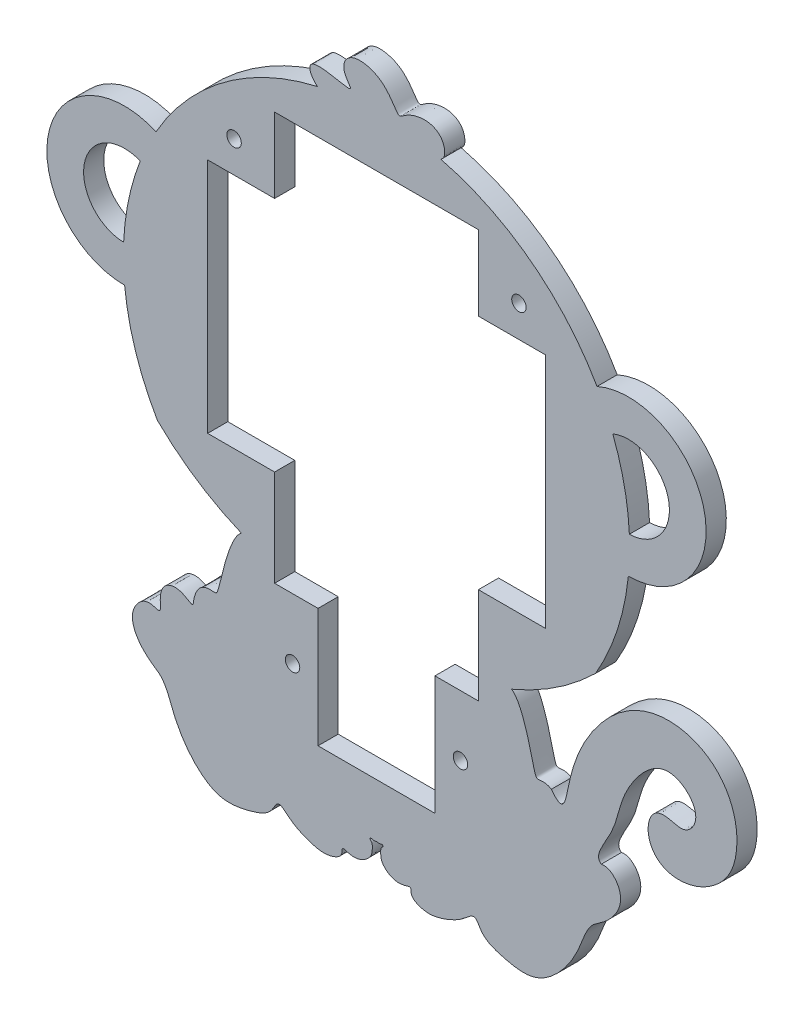
from build123d import *

# Parameters (mm, degrees)
MODEL_R             = 1.7
BOSS_EXTRUDE1_DEPTH = 4.75


with BuildPart() as part:
    # Model → Boss-Extrude1 (new body)
    # profile 1 of 10: a face of its own
    with BuildSketch(Plane.XY):
        with BuildLine():
            Line((-368.527593989, 362.029236712), (-368.527593989, 390.029236712))
            Line((-368.527593989, 390.029236712), (-378.744585616, 390.029236712))
            Line((-378.744585616, 390.029236712), (-378.744585616, 393.669465221))
            ThreePointArc((-378.744585616, 393.669465221), (-382.691869771, 394.869260736), (-386.551251239, 396.327251189))
            add(Edge.make_bspline(
                [(-386.551251239, 396.327251189), (-386.916052394, 396.079204413), (-387.365984237, 395.634433922), (-387.896797281, 394.898644088), (-388.503330161, 393.757203334), (-389.171452603, 392.131003368), (-389.577925954, 391.014654975), (-389.970270784, 389.819275468), (-390.419319319, 388.323421516), (-390.83332726, 386.804935246), (-391.201587088, 385.34636593), (-391.516679205, 384.035346949), (-391.781698399, 382.944281063), (-391.975355466, 382.209449772), (-392.15403089, 381.664820315), (-392.336737386, 381.31109681), (-392.551498562, 381.129911234), (-392.833479669, 381.082225409), (-393.211479982, 381.115525432), (-393.693425125, 381.169472404), (-394.261194431, 381.182617586), (-394.881047474, 381.099420015), (-395.510435114, 380.877573231), (-396.105936728, 380.494485307), (-396.631517428, 379.95585235), (-397.063963964, 379.297531395), (-397.39210439, 378.573969962), (-397.617276013, 377.849585475), (-397.753517497, 377.188797135), (-397.82736951, 376.647023839), (-397.879059879, 376.260334721), (-397.959633552, 376.038465419), (-398.114782848, 375.972462073), (-398.366034123, 376.040823891), (-398.706936261, 376.21469148), (-399.120091801, 376.460086445), (-399.591458011, 376.741171495), (-400.117952431, 377.022315753), (-400.699774201, 377.268862798), (-401.463798734, 377.484035353), (-402.300244633, 377.553822048), (-403.174091852, 377.426716269), (-404.002173047, 377.065864722), (-404.698224792, 376.46441147), (-405.153470998, 375.811835942), (-405.461269956, 375.032169593), (-405.619922332, 374.166940367), (-405.657953521, 373.27889911), (-405.626485489, 372.442499072), (-405.587522811, 371.731075977), (-405.603727217, 371.205296174), (-405.727364814, 370.900755869), (-405.990085682, 370.81668236), (-406.39105056, 370.902146782), (-406.905602715, 371.07475403), (-407.496249881, 371.243305804), (-408.122207542, 371.327500075), (-408.751072773, 371.282728006), (-409.35960202, 371.097539496), (-409.931191749, 370.782809916), (-410.454421679, 370.36348433), (-410.921225043, 369.869653892), (-411.325051593, 369.32694511), (-411.659572418, 368.750331411), (-411.919102239, 368.147846593), (-412.098696202, 367.522400938), (-412.194371621, 366.874422897), (-412.203287138, 366.20397783), (-412.092164868, 365.237355517), (-411.795780763, 364.240492853), (-411.25356719, 363.0979097), (-410.505546493, 362.004000685), (-409.628552466, 361.020862692), (-408.940714048, 360.363039305), (-408.261699769, 359.795455705), (-407.719269628, 359.383631865), (-407.21381394, 359.028246689), (-406.753242924, 358.71792316), (-406.337217025, 358.432587935), (-405.958407604, 358.146100067), (-405.606436892, 357.832150323), (-405.270933307, 357.469037169), (-404.945150571, 357.045248498), (-404.628769556, 356.563710073), (-404.325203667, 356.036561227), (-404.039420225, 355.480831591), (-403.775511082, 354.913678765), (-403.486293011, 354.234906798), (-403.22438966, 353.563780813), (-402.971971356, 352.893055429), (-402.704512752, 352.203026621), (-402.401681187, 351.478012783), (-402.062584898, 350.721085445), (-401.674639208, 349.927966936), (-401.239024686, 349.111007443), (-400.763113802, 348.289788183), (-400.254340005, 347.481959495), (-399.722634495, 346.692998852), (-399.163365939, 345.932140679), (-398.574323946, 345.19923963), (-397.949478676, 344.488835597), (-397.28186749, 343.797089708), (-396.693729261, 343.232918759), (-395.94666487, 342.573889335), (-395.145878925, 341.947793479), (-394.290902186, 341.375211916), (-393.384167186, 340.882126765), (-392.430043668, 340.491703263), (-391.606002687, 340.243986907), (-390.756002743, 340.079446261), (-389.883129061, 339.998262902), (-388.990604918, 339.995014447), (-388.082210988, 340.060658996), (-387.162607569, 340.183979577), (-386.237707408, 340.353267946), (-385.315001235, 340.557855636), (-384.403963907, 340.789827334), (-383.516286063, 341.045384095), (-382.66652457, 341.327024633), (-381.871318875, 341.642937555), (-381.146754324, 342.002777686), (-380.506140062, 342.414272763), (-379.957720387, 342.879646699), (-379.50217975, 343.391768319), (-379.130782998, 343.931240964), (-378.821858803, 344.461005534), (-378.544703377, 344.932108886), (-378.267774642, 345.29593373), (-377.965518245, 345.51436395), (-377.625879138, 345.570992742), (-377.257148561, 345.481328236), (-376.875804119, 345.278776475), (-376.496250149, 345.00253689), (-376.11706805, 344.682307942), (-375.720845967, 344.335154988), (-375.283150649, 343.970625574), (-374.779103973, 343.593551859), (-374.190278948, 343.207542556), (-373.377688666, 342.741091189), (-372.449841911, 342.284943077), (-371.448923671, 341.861784637), (-370.434447105, 341.496921291), (-369.457107924, 341.211628122), (-368.685864943, 341.035221995), (-367.964373903, 340.924859402), (-367.285516994, 340.881136877), (-366.635919607, 340.902071878), (-366.001452121, 340.984188477), (-365.373937537, 341.123915256), (-364.75630659, 341.318535957), (-364.170945702, 341.568094094), (-363.657947564, 341.87428189), (-363.258368215, 342.235110671), (-362.999601239, 342.639822419), (-362.882834785, 343.065290294), (-362.862380856, 343.467877411), (-362.860328863, 343.794256059), (-362.800804618, 344.002021381), (-362.645316427, 344.082202864), (-362.403915174, 344.064482859), (-362.091030238, 343.983757423), (-361.712216892, 343.868949898), (-361.271123238, 343.746963048), (-360.772201451, 343.643387937), (-360.225145899, 343.584551667), (-359.643851104, 343.593953505), (-359.045609545, 343.68889199), (-358.331130904, 343.914571841), (-357.653031997, 344.271758954), (-357.055699253, 344.71601695), (-356.577458743, 345.17871164), (-356.233391408, 345.621031596), (-356.033125086, 345.975351534), (-355.902737419, 346.342883089), (-355.820827463, 346.757252518), (-355.769760706, 347.236551212), (-355.745106949, 347.759570584), (-355.762413964, 348.248781386), (-355.838587496, 348.623368474), (-355.977712536, 348.837568218), (-356.150848594, 348.941800594), (-356.292732028, 349.075710758), (-356.33646563, 349.288102762), (-356.236344626, 349.443149765), (-355.997125235, 349.455364951), (-355.677539018, 349.382302231), (-355.345578077, 349.318848286), (-355.1000792, 349.319880609), (-354.932396923, 349.356987082), (-354.827970147, 349.397996872), (-354.777593989, 349.422562594)],
                knots=[0, 0, 0, 0, 0, 0, 0.02, 0.025, 0.03, 0.035, 0.04, 0.045, 0.05, 0.06, 0.065, 0.07, 0.075, 0.08, 0.085, 0.09, 0.095, 0.1, 0.105, 0.11, 0.115, 0.12, 0.125, 0.13, 0.135, 0.14, 0.145, 0.15, 0.155, 0.16, 0.165, 0.17, 0.175, 0.18, 0.185, 0.19, 0.195, 0.2, 0.205, 0.21, 0.22, 0.225, 0.23, 0.235, 0.24, 0.245, 0.25, 0.255, 0.26, 0.265, 0.27, 0.275, 0.28, 0.285, 0.29, 0.295, 0.3, 0.305, 0.31, 0.315, 0.32, 0.325, 0.33, 0.335, 0.34, 0.345, 0.35, 0.355, 0.36, 0.375, 0.38, 0.39, 0.395, 0.4, 0.405, 0.41, 0.415, 0.42, 0.425, 0.43, 0.435, 0.44, 0.445, 0.45, 0.455, 0.46, 0.465, 0.47, 0.48, 0.485, 0.49, 0.495, 0.5, 0.51, 0.515, 0.52, 0.525, 0.53, 0.54, 0.545, 0.55, 0.555, 0.56, 0.565, 0.575, 0.58, 0.585, 0.59, 0.595, 0.6, 0.605, 0.61, 0.615, 0.62, 0.625, 0.63, 0.635, 0.64, 0.645, 0.65, 0.655, 0.66, 0.665, 0.67, 0.675, 0.68, 0.685, 0.69, 0.695, 0.7, 0.705, 0.71, 0.715, 0.72, 0.725, 0.73, 0.735, 0.74, 0.745, 0.755, 0.76, 0.765, 0.77, 0.775, 0.78, 0.785, 0.79, 0.795, 0.8, 0.805, 0.81, 0.815, 0.82, 0.825, 0.83, 0.835, 0.84, 0.845, 0.85, 0.855, 0.86, 0.865, 0.87, 0.875, 0.88, 0.885, 0.89, 0.895, 0.905, 0.91, 0.915, 0.92, 0.925, 0.93, 0.935, 0.94, 0.945, 0.95, 0.955, 0.96, 0.965, 0.97, 0.975, 0.98, 0.985, 0.99, 0.995, 1, 1, 1, 1, 1, 1], degree=5))
            add(Edge.make_bspline(
                [(-301.898947089, 371.249991702), (-301.80670497, 371.265018138), (-301.589974955, 371.293910279), (-301.244905456, 371.313674079), (-300.773941346, 371.273545454), (-300.195585957, 371.097539496), (-299.623996228, 370.782809916), (-299.100766299, 370.36348433), (-298.633962934, 369.869653892), (-298.230136384, 369.32694511), (-297.89561556, 368.750331411), (-297.636085738, 368.147846593), (-297.456491776, 367.522400938), (-297.360816357, 366.874422897), (-297.35190084, 366.20397783), (-297.463023109, 365.237355517), (-297.759407215, 364.240492853), (-298.301620787, 363.0979097), (-299.049641484, 362.004000685), (-299.926635511, 361.020862692), (-300.61447393, 360.363039305), (-301.293488209, 359.795455705), (-301.83591835, 359.383631865), (-302.341374037, 359.028246689), (-302.801945054, 358.71792316), (-303.217970952, 358.432587935), (-303.596780374, 358.146100067), (-303.948751085, 357.832150323), (-304.28425467, 357.469037169), (-304.610037406, 357.045248498), (-304.926418421, 356.563710073), (-305.22998431, 356.036561227), (-305.515767753, 355.480831591), (-305.779676896, 354.913678765), (-306.068894967, 354.234906798), (-306.330798317, 353.563780813), (-306.583216622, 352.893055429), (-306.850675225, 352.203026621), (-307.15350679, 351.478012783), (-307.492603079, 350.721085445), (-307.88054877, 349.927966936), (-308.316163291, 349.111007443), (-308.792074176, 348.289788183), (-309.300847972, 347.481959495), (-309.832553482, 346.692998852), (-310.391822039, 345.932140679), (-310.980864031, 345.19923963), (-311.605709301, 344.488835597), (-312.273320488, 343.797089708), (-312.861458716, 343.232918759), (-313.608523108, 342.573889335), (-314.409309053, 341.947793479), (-315.264285791, 341.375211916), (-316.171020791, 340.882126765), (-317.125144309, 340.491703263), (-317.949185291, 340.243986907), (-318.799185234, 340.079446261), (-319.672058916, 339.998262902), (-320.564583059, 339.995014447), (-321.472976989, 340.060658996), (-322.392580408, 340.183979577), (-323.31748057, 340.353267946), (-324.240186742, 340.557855636), (-325.151224071, 340.789827334), (-326.038901914, 341.045384095), (-326.888663407, 341.327024633), (-327.683869103, 341.642937555), (-328.408433654, 342.002777686), (-329.049047915, 342.414272763), (-329.59746759, 342.879646699), (-330.053008227, 343.391768319), (-330.42440498, 343.931240964), (-330.733329174, 344.461005534), (-331.0104846, 344.932108886), (-331.287413335, 345.29593373), (-331.589669732, 345.51436395), (-331.929308839, 345.570992742), (-332.298039416, 345.481328236), (-332.679383858, 345.278776475), (-333.058937829, 345.00253689), (-333.438119927, 344.682307942), (-333.83434201, 344.335154988), (-334.272037329, 343.970625574), (-334.776084004, 343.593551859), (-335.364909029, 343.207542556), (-336.177499311, 342.741091189), (-337.105346067, 342.284943077), (-338.106264306, 341.861784637), (-339.120740873, 341.496921291), (-340.098080053, 341.211628122), (-340.869323035, 341.035221995), (-341.590814074, 340.924859402), (-342.269670984, 340.881136877), (-342.91926837, 340.902071878), (-343.553735856, 340.984188477), (-344.18125044, 341.123915256), (-344.798881387, 341.318535957), (-345.384242276, 341.568094094), (-345.897240413, 341.87428189), (-346.296819762, 342.235110671), (-346.555586738, 342.639822419), (-346.672353193, 343.065290294), (-346.692807122, 343.467877411), (-346.694859114, 343.794256059), (-346.754383359, 344.002021381), (-346.909871551, 344.082202864), (-347.151272803, 344.064482859), (-347.46415774, 343.983757423), (-347.842971085, 343.868949898), (-348.284064739, 343.746963048), (-348.782986526, 343.643387937), (-349.330042079, 343.584551667), (-349.911336873, 343.593953505), (-350.509578433, 343.68889199), (-351.224057074, 343.914571841), (-351.902155981, 344.271758954), (-352.499488725, 344.71601695), (-352.977729235, 345.17871164), (-353.321796569, 345.621031596), (-353.522062892, 345.975351534), (-353.652450559, 346.342883089), (-353.734360514, 346.757252518), (-353.785427271, 347.236551212), (-353.810081029, 347.759570584), (-353.792774013, 348.248781386), (-353.716600481, 348.623368474), (-353.577475441, 348.837568218), (-353.404339383, 348.941800594), (-353.262455949, 349.075710758), (-353.218722348, 349.288102762), (-353.318843352, 349.443149765), (-353.558062742, 349.455364951), (-353.87764896, 349.382302231), (-354.2096099, 349.318848286), (-354.455108777, 349.319880609), (-354.622791055, 349.356987082), (-354.727217831, 349.397996872), (-354.777593989, 349.422562594)],
                knots=[0.291239622, 0.291239622, 0.291239622, 0.291239622, 0.291239622, 0.291239622, 0.295, 0.3, 0.305, 0.31, 0.315, 0.32, 0.325, 0.33, 0.335, 0.34, 0.345, 0.35, 0.355, 0.36, 0.375, 0.38, 0.39, 0.395, 0.4, 0.405, 0.41, 0.415, 0.42, 0.425, 0.43, 0.435, 0.44, 0.445, 0.45, 0.455, 0.46, 0.465, 0.47, 0.48, 0.485, 0.49, 0.495, 0.5, 0.51, 0.515, 0.52, 0.525, 0.53, 0.54, 0.545, 0.55, 0.555, 0.56, 0.565, 0.575, 0.58, 0.585, 0.59, 0.595, 0.6, 0.605, 0.61, 0.615, 0.62, 0.625, 0.63, 0.635, 0.64, 0.645, 0.65, 0.655, 0.66, 0.665, 0.67, 0.675, 0.68, 0.685, 0.69, 0.695, 0.7, 0.705, 0.71, 0.715, 0.72, 0.725, 0.73, 0.735, 0.74, 0.745, 0.755, 0.76, 0.765, 0.77, 0.775, 0.78, 0.785, 0.79, 0.795, 0.8, 0.805, 0.81, 0.815, 0.82, 0.825, 0.83, 0.835, 0.84, 0.845, 0.85, 0.855, 0.86, 0.865, 0.87, 0.875, 0.88, 0.885, 0.89, 0.895, 0.905, 0.91, 0.915, 0.92, 0.925, 0.93, 0.935, 0.94, 0.945, 0.95, 0.955, 0.96, 0.965, 0.97, 0.975, 0.98, 0.985, 0.99, 0.995, 1, 1, 1, 1, 1, 1], degree=5))
            add(Edge.make_bspline(
                [(-312.570027786, 379.374371389), (-312.559271777, 379.355886568), (-312.470544427, 379.20149493), (-312.316103558, 378.902890391), (-312.124199573, 378.448878813), (-311.937911965, 377.849585475), (-311.80167048, 377.188797135), (-311.727818467, 376.647023839), (-311.676128098, 376.260334721), (-311.595554426, 376.038465419), (-311.440405129, 375.972462073), (-311.189153854, 376.040823891), (-310.848251716, 376.21469148), (-310.435096176, 376.460086445), (-309.963729966, 376.741171495), (-309.437235546, 377.022315753), (-308.855413777, 377.268862798), (-308.091389244, 377.484035353), (-307.254943345, 377.553822048), (-306.381096125, 377.426716269), (-305.55301493, 377.065864722), (-304.856963186, 376.46441147), (-304.401716979, 375.811835942), (-304.093918022, 375.032169593), (-303.935265645, 374.166940367), (-303.897234456, 373.27889911), (-303.928702489, 372.442499072), (-303.967665167, 371.731075977), (-303.951460761, 371.205296174), (-303.827823164, 370.900755869), (-303.565102295, 370.81668236), (-303.164137417, 370.902146782), (-302.726981679, 371.048791293), (-302.352600007, 371.158775291), (-302.081981557, 371.218669096), (-301.929355044, 371.245038182), (-301.898947089, 371.249991702)],
                knots=[0.134317153, 0.134317153, 0.134317153, 0.134317153, 0.134317153, 0.134317153, 0.135, 0.14, 0.145, 0.15, 0.155, 0.16, 0.165, 0.17, 0.175, 0.18, 0.185, 0.19, 0.195, 0.2, 0.205, 0.21, 0.22, 0.225, 0.23, 0.235, 0.24, 0.245, 0.25, 0.255, 0.26, 0.265, 0.27, 0.275, 0.28, 0.285, 0.29, 0.291239622, 0.291239622, 0.291239622, 0.291239622, 0.291239622, 0.291239622], degree=5))
            add(Edge.make_bspline(
                [(-313.6607794, 380.60362174), (-313.444699739, 380.320105618), (-313.214558019, 380.036320029), (-312.995336379, 379.78705437), (-312.787038261, 379.572315107), (-312.589582176, 379.391986634), (-312.570027786, 379.374371389)],
                knots=[0, 0, 0, 0, 0, 0, 0.01, 0.011105874, 0.011105874, 0.011105874, 0.011105874, 0.011105874, 0.011105874], degree=5))
            add(Edge.make_bspline(
                [(-323.003936738, 396.327251189), (-322.639135583, 396.079204413), (-322.18920374, 395.634433922), (-321.658390696, 394.898644088), (-321.051857816, 393.757203334), (-320.383735374, 392.131003368), (-319.977262023, 391.014654975), (-319.584917193, 389.819275468), (-319.135868658, 388.323421516), (-318.721860717, 386.804935246), (-318.353600889, 385.34636593), (-318.038508773, 384.035346949), (-317.773489578, 382.944281063), (-317.579832511, 382.209449772), (-317.401157087, 381.664820315), (-317.218450591, 381.31109681), (-317.003689416, 381.129911234), (-316.721708308, 381.082225409), (-316.343707995, 381.115525432), (-315.861762853, 381.169472404), (-315.293993546, 381.182617586), (-314.716438841, 381.105097359), (-314.256472836, 380.951412883), (-313.932453608, 380.783648044), (-313.737120758, 380.657216991), (-313.6607794, 380.60362174)],
                knots=[0, 0, 0, 0, 0, 0, 0.02, 0.025, 0.03, 0.035, 0.04, 0.045, 0.05, 0.06, 0.065, 0.07, 0.075, 0.08, 0.085, 0.09, 0.095, 0.1, 0.105, 0.11, 0.115, 0.12, 0.123294018, 0.123294018, 0.123294018, 0.123294018, 0.123294018, 0.123294018], degree=5))
            ThreePointArc((-323.003936738, 396.327251189), (-326.863318207, 394.869260736), (-330.810602362, 393.669465221))
            Line((-330.810602362, 393.669465221), (-330.810602362, 390.029236712))
            Line((-330.810602362, 390.029236712), (-341.027593989, 390.029236712))
            Line((-341.027593989, 390.029236712), (-341.027593989, 362.029236712))
            Line((-341.027593989, 362.029236712), (-354.777593989, 362.029236712))
            Line((-354.777593989, 362.029236712), (-368.527593989, 362.029236712))
        make_face()
        with Locations((-374.527593989, 375.779236712)):
            Circle(MODEL_R, mode=Mode.SUBTRACT)
        with Locations((-335.027593989, 375.779236712)):
            Circle(MODEL_R, mode=Mode.SUBTRACT)
    # profile 2 of 10: a face of its own
    with BuildSketch(Plane.XY):
        with BuildLine():
            ThreePointArc((-386.551251239, 396.327251189), (-382.691869771, 394.869260736), (-378.744585616, 393.669465221))
            Line((-378.744585616, 393.669465221), (-378.744585616, 412.69380901))
            Line((-378.744585616, 412.69380901), (-394.493313544, 412.69380901))
            Line((-394.493313544, 412.69380901), (-394.493313544, 468.407050822))
            Line((-394.493313544, 468.407050822), (-378.744585616, 468.407050822))
            Line((-378.744585616, 468.407050822), (-378.744585616, 486.018531516))
            Line((-378.744585616, 486.018531516), (-368.527593989, 486.018531516))
            Line((-368.527593989, 486.018531516), (-354.777593989, 486.018531516))
            Line((-354.777593989, 486.018531516), (-341.027593989, 486.018531516))
            Line((-341.027593989, 486.018531516), (-330.810602362, 486.018531516))
            Line((-330.810602362, 486.018531516), (-330.810602362, 468.407050822))
            Line((-330.810602362, 468.407050822), (-315.061874433, 468.407050822))
            Line((-315.061874433, 468.407050822), (-315.061874433, 412.69380901))
            Line((-315.061874433, 412.69380901), (-330.810602362, 412.69380901))
            Line((-330.810602362, 412.69380901), (-330.810602362, 393.669465221))
            ThreePointArc((-330.810602362, 393.669465221), (-326.863318207, 394.869260736), (-323.003936738, 396.327251189))
            ThreePointArc((-323.003936738, 396.327251189), (-312.498766528, 401.927835806), (-303.24831057, 409.421447336))
            ThreePointArc((-303.24831057, 409.421447336), (-298.124131535, 420.844790734), (-295.53920269, 433.095020448))
            ThreePointArc((-295.53920269, 433.095020448), (-313.368807432, 447.58134096), (-302.913653982, 468.037099404))
            ThreePointArc((-302.913653982, 468.037099404), (-318.490243046, 485.80537303), (-339.811140885, 495.991686882))
            ThreePointArc((-339.811140885, 495.991686882), (-347.238992057, 497.333297382), (-354.777593989, 497.710620444))
            ThreePointArc((-354.777593989, 497.710620444), (-361.756537627, 497.394857379), (-368.648535438, 496.252173352))
            ThreePointArc((-368.648535438, 496.252173352), (-390.614540969, 486.143224047), (-406.641533995, 468.037099404))
            ThreePointArc((-406.641533995, 468.037099404), (-398.743498013, 461.302506057), (-395.792899727, 451.351240325))
            ThreePointArc((-395.792899727, 451.351240325), (-401.128311473, 438.453852881), (-414.015985287, 433.095020448))
            ThreePointArc((-414.015985287, 433.095020448), (-411.431056442, 420.844790734), (-406.306877408, 409.421447336))
            ThreePointArc((-406.306877408, 409.421447336), (-397.05642145, 401.927835806), (-386.551251239, 396.327251189))
        make_face()
        with Locations((-388.277593989, 475.779236712)):
            Circle(MODEL_R, mode=Mode.SUBTRACT)
        with Locations((-321.277593989, 475.779236712)):
            Circle(MODEL_R, mode=Mode.SUBTRACT)
    # profile 3 of 10: a face of its own
    with BuildSketch(Plane.XY):
        with BuildLine():
            ThreePointArc((-414.252942121, 441.734311673), (-414.293685719, 437.410298949), (-414.015985287, 433.095020448))
            ThreePointArc((-414.015985287, 433.095020448), (-401.128311473, 438.453852881), (-395.792899727, 451.351240325))
            ThreePointArc((-395.792899727, 451.351240325), (-398.743498013, 461.302506057), (-406.641533995, 468.037099404))
            ThreePointArc((-406.641533995, 468.037099404), (-408.639341239, 464.202061949), (-410.349392029, 460.23035295))
            ThreePointArc((-410.349392029, 460.23035295), (-406.045552356, 456.686901216), (-404.430062035, 451.351240325))
            ThreePointArc((-404.430062035, 451.351240325), (-407.319864805, 444.477844332), (-414.252942121, 441.734311673))
        make_face()
    # profile 4 of 10: a face of its own
    with BuildSketch(Plane.XY):
        with BuildLine():
            ThreePointArc((-406.641533995, 468.037099404), (-431.911918909, 455.12113969), (-414.015985287, 433.095020448))
            ThreePointArc((-414.015985287, 433.095020448), (-414.293685719, 437.410298949), (-414.252942121, 441.734311673))
            ThreePointArc((-414.252942121, 441.734311673), (-423.460915188, 453.337573366), (-410.349392029, 460.23035295))
            ThreePointArc((-410.349392029, 460.23035295), (-408.639341239, 464.202061949), (-406.641533995, 468.037099404))
        make_face()
    # profile 5 of 10: a face of its own
    with BuildSketch(Plane.XY):
        with BuildLine():
            add(Edge.make_bspline(
                [(-312.570027786, 379.374371389), (-312.559271777, 379.355886568), (-312.470544427, 379.20149493), (-312.316103558, 378.902890391), (-312.124199573, 378.448878813), (-311.937911965, 377.849585475), (-311.80167048, 377.188797135), (-311.727818467, 376.647023839), (-311.676128098, 376.260334721), (-311.595554426, 376.038465419), (-311.440405129, 375.972462073), (-311.189153854, 376.040823891), (-310.848251716, 376.21469148), (-310.435096176, 376.460086445), (-309.963729966, 376.741171495), (-309.437235546, 377.022315753), (-308.855413777, 377.268862798), (-308.091389244, 377.484035353), (-307.254943345, 377.553822048), (-306.381096125, 377.426716269), (-305.55301493, 377.065864722), (-304.856963186, 376.46441147), (-304.401716979, 375.811835942), (-304.093918022, 375.032169593), (-303.935265645, 374.166940367), (-303.897234456, 373.27889911), (-303.928702489, 372.442499072), (-303.967665167, 371.731075977), (-303.951460761, 371.205296174), (-303.827823164, 370.900755869), (-303.565102295, 370.81668236), (-303.164137417, 370.902146782), (-302.726981679, 371.048791293), (-302.352600007, 371.158775291), (-302.081981557, 371.218669096), (-301.929355044, 371.245038182), (-301.898947089, 371.249991702)],
                knots=[0.134317153, 0.134317153, 0.134317153, 0.134317153, 0.134317153, 0.134317153, 0.135, 0.14, 0.145, 0.15, 0.155, 0.16, 0.165, 0.17, 0.175, 0.18, 0.185, 0.19, 0.195, 0.2, 0.205, 0.21, 0.22, 0.225, 0.23, 0.235, 0.24, 0.245, 0.25, 0.255, 0.26, 0.265, 0.27, 0.275, 0.28, 0.285, 0.29, 0.291239622, 0.291239622, 0.291239622, 0.291239622, 0.291239622, 0.291239622], degree=5))
            add(Edge.make_bspline(
                [(-312.570027786, 379.374371389), (-312.412759184, 379.232698603), (-312.093427145, 378.978603713), (-311.652711141, 378.741820379), (-311.154948108, 378.73190092), (-310.673366326, 379.216827317), (-310.292721218, 380.178229359), (-309.968617434, 381.523898785), (-309.640561499, 383.162221439), (-309.250925564, 385.001542652), (-308.755268533, 386.963327702), (-308.001652746, 389.39378453), (-307.030109551, 391.853114628), (-305.836320205, 394.276384281), (-304.437971019, 396.623488316), (-302.855961089, 398.859622636), (-301.423227661, 400.629872898), (-299.570759796, 402.614165823), (-297.55376872, 404.384775694), (-295.374305071, 405.888080142), (-292.650761978, 407.269272218), (-289.32996603, 408.269637229), (-286.299006859, 408.594090842), (-283.265109328, 408.344541641), (-280.379149882, 407.539092006), (-278.092782759, 406.4785487), (-276.348901152, 405.366769995), (-274.485083983, 403.787796033), (-272.937052277, 401.94602382), (-271.727774145, 399.906931327), (-270.857132325, 397.745077765), (-270.306480744, 395.538773505), (-270.046205794, 393.710009769), (-269.965016257, 391.930118455), (-270.040978563, 390.2346489), (-270.252293644, 388.652401735), (-270.579877607, 387.201933377), (-271.009722971, 385.888830428), (-271.535866394, 384.70099922), (-272.161214125, 383.610945588), (-272.895776168, 382.586894991), (-273.755463023, 381.601444913), (-274.760882323, 380.641693853), (-275.93548394, 379.717384281), (-277.297305988, 378.856918007), (-278.851525965, 378.104383008), (-280.582328457, 377.516407907), (-282.445893609, 377.158636255), (-284.360670175, 377.103581142), (-286.219105708, 377.4170411), (-287.903220924, 378.142688713), (-289.299028152, 379.286710653), (-290.311010342, 380.803687119), (-290.877596402, 382.578851159), (-290.983205819, 384.420926362), (-290.650627543, 386.112012698), (-289.935960884, 387.451354667), (-288.922339625, 388.299673225), (-287.714778317, 388.627521421), (-286.432799241, 388.549506411), (-285.187617596, 388.257647228), (-284.061898655, 387.966698541), (-283.086509475, 387.852497186), (-282.224227316, 388.000042889), (-281.424791372, 388.432592409), (-280.672983329, 389.134306182), (-280.042701572, 390.076155472), (-279.651481692, 391.214486489), (-279.614594112, 392.489509944), (-279.993445178, 393.822748232), (-280.76403377, 395.118025382), (-281.851079655, 396.27377504), (-283.152043236, 397.193839546), (-284.562929688, 397.798008073), (-286.008600232, 398.034757091), (-287.450506474, 397.88487723), (-288.870633099, 397.355559995), (-290.261394711, 396.477163759), (-291.614267711, 395.298727975), (-292.906052001, 393.884476201), (-294.101045993, 392.307630147), (-295.162040147, 390.642897503), (-296.05819531, 388.959584105), (-296.774951218, 387.313965856), (-297.321372994, 385.743083541), (-297.742815902, 384.255163919), (-298.11469187, 382.832378816), (-298.518808306, 381.445147803), (-299.023340821, 380.063869225), (-299.663776374, 378.670412259), (-300.417430607, 377.272852531), (-301.203239072, 375.907021068), (-301.910810817, 374.622658725), (-302.422921716, 373.473093417), (-302.638326758, 372.504569396), (-302.527935786, 371.895313524), (-302.278358106, 371.535036125), (-302.03777992, 371.337842664), (-301.898947089, 371.249991702)],
                knots=[0.011105874, 0.011105874, 0.011105874, 0.011105874, 0.011105874, 0.011105874, 0.02, 0.03, 0.04, 0.05, 0.06, 0.07, 0.08, 0.09, 0.1, 0.11, 0.13, 0.14, 0.15, 0.16, 0.17, 0.18, 0.2, 0.21, 0.22, 0.24, 0.26, 0.27, 0.28, 0.29, 0.3, 0.31, 0.33, 0.34, 0.35, 0.36, 0.37, 0.38, 0.39, 0.4, 0.41, 0.42, 0.43, 0.44, 0.45, 0.46, 0.47, 0.48, 0.49, 0.5, 0.51, 0.52, 0.53, 0.54, 0.55, 0.56, 0.57, 0.58, 0.59, 0.6, 0.61, 0.62, 0.63, 0.64, 0.65, 0.66, 0.67, 0.68, 0.69, 0.7, 0.71, 0.72, 0.73, 0.74, 0.75, 0.76, 0.77, 0.78, 0.79, 0.8, 0.81, 0.82, 0.83, 0.84, 0.85, 0.86, 0.87, 0.88, 0.89, 0.9, 0.91, 0.92, 0.93, 0.94, 0.95, 0.96, 0.97, 0.98, 0.99, 1, 1, 1, 1, 1, 1], degree=5))
        make_face()
    # profile 6 of 10: a face of its own
    with BuildSketch(Plane.XY):
        with BuildLine():
            ThreePointArc((-295.302245857, 441.734311673), (-295.261502258, 437.410298949), (-295.53920269, 433.095020448))
            ThreePointArc((-295.53920269, 433.095020448), (-282.608650806, 438.430402071), (-277.24978825, 451.351240325))
            ThreePointArc((-277.24978825, 451.351240325), (-285.554772518, 466.656892039), (-302.913653982, 468.037099404))
            ThreePointArc((-302.913653982, 468.037099404), (-300.915846738, 464.202061949), (-299.205795948, 460.23035295))
            ThreePointArc((-299.205795948, 460.23035295), (-290.170377358, 459.354837696), (-285.886950557, 451.351240325))
            ThreePointArc((-285.886950557, 451.351240325), (-288.632642257, 444.621955402), (-295.302245857, 441.734311673))
        make_face()
    # profile 7 of 10: a face of its own
    with BuildSketch(Plane.XY):
        with BuildLine():
            ThreePointArc((-302.913653982, 468.037099404), (-313.368807432, 447.58134096), (-295.53920269, 433.095020448))
            ThreePointArc((-295.53920269, 433.095020448), (-295.261502258, 437.410298949), (-295.302245857, 441.734311673))
            ThreePointArc((-295.302245857, 441.734311673), (-304.917803711, 449.364907283), (-299.205795948, 460.23035295))
            ThreePointArc((-299.205795948, 460.23035295), (-300.915846738, 464.202061949), (-302.913653982, 468.037099404))
        make_face()
    # profile 8 of 10: a face of its own
    with BuildSketch(Plane.XY):
        with BuildLine():
            ThreePointArc((-410.349392029, 460.23035295), (-413.050642353, 451.140507471), (-414.252942121, 441.734311673))
            ThreePointArc((-414.252942121, 441.734311673), (-407.319864805, 444.477844332), (-404.430062035, 451.351240325))
            ThreePointArc((-404.430062035, 451.351240325), (-406.045552356, 456.686901216), (-410.349392029, 460.23035295))
        make_face()
    # profile 9 of 10: a face of its own
    with BuildSketch(Plane.XY):
        with BuildLine():
            ThreePointArc((-299.205795948, 460.23035295), (-304.917803711, 449.364907283), (-295.302245857, 441.734311673))
            ThreePointArc((-295.302245857, 441.734311673), (-296.504545624, 451.140507471), (-299.205795948, 460.23035295))
        make_face()
    # profile 10 of 10: a face of its own
    with BuildSketch(Plane.XY):
        with BuildLine():
            add(Edge.make_bspline(
                [(-368.648535438, 496.252173352), (-368.744458236, 496.318852064), (-368.933155722, 496.46135137), (-369.206763211, 496.702529524), (-369.552638711, 497.078952875), (-369.945448044, 497.635151945), (-370.27396009, 498.258937778), (-370.49029081, 498.914952019), (-370.51070775, 499.541563445), (-370.238365938, 500.064302422), (-369.5990972, 500.417471707), (-368.57162488, 500.562380095), (-367.22355688, 500.508813977), (-365.687080465, 500.304348965), (-364.130399482, 500.021394498), (-362.730437113, 499.744991582), (-361.645780778, 499.560560003), (-360.987783845, 499.541133492), (-360.796409046, 499.736067669), (-361.003653893, 500.155847055), (-361.456239643, 500.775355547), (-361.969645158, 501.546412025), (-362.368346783, 502.406968262), (-362.540769792, 503.292531993), (-362.454363932, 504.143316727), (-362.127001431, 504.906996063), (-361.609010526, 505.54285956), (-360.962354705, 506.024792223), (-360.237689537, 506.346315269), (-359.465109655, 506.519028644), (-358.662050204, 506.563781119), (-357.836770513, 506.503364206), (-356.993360104, 506.355416269), (-356.136711355, 506.123246396), (-355.27524615, 505.794703449), (-354.419874931, 505.352916652), (-353.583850229, 504.783872945), (-352.782377599, 504.085819177), (-352.032065864, 503.276653785), (-351.351103862, 502.405268117), (-350.756796891, 501.550400765), (-350.259062752, 500.800910062), (-349.854900796, 500.240489256), (-349.52240587, 499.930593307), (-349.215031159, 499.894076524), (-348.855526802, 500.098537748), (-348.362085472, 500.475509867), (-347.67170771, 500.938251599), (-346.770031422, 501.402187782), (-345.688786994, 501.792289415), (-344.48987856, 502.045099565), (-343.253856136, 502.112491058), (-342.066559862, 501.964757688), (-341.006667622, 501.593968073), (-340.132609258, 501.01739116), (-339.470394525, 500.280534755), (-339.021946768, 499.447136213), (-338.772548612, 498.589873373), (-338.698846344, 497.780410896), (-338.775989921, 497.080683391), (-338.986639614, 496.531262609), (-339.255348506, 496.227388525), (-339.511863577, 496.0787419), (-339.707309513, 496.014838841), (-339.811140885, 495.991686882)],
                knots=[0, 0, 0, 0, 0, 0, 0.016666667, 0.033333333, 0.05, 0.066666667, 0.083333333, 0.1, 0.116666667, 0.133333333, 0.15, 0.166666667, 0.183333333, 0.2, 0.216666667, 0.233333333, 0.25, 0.266666667, 0.283333333, 0.3, 0.316666667, 0.333333333, 0.35, 0.366666667, 0.383333333, 0.4, 0.416666667, 0.433333333, 0.45, 0.466666667, 0.483333333, 0.5, 0.516666667, 0.533333333, 0.55, 0.566666667, 0.583333333, 0.6, 0.616666667, 0.633333333, 0.65, 0.666666667, 0.683333333, 0.7, 0.716666667, 0.733333333, 0.75, 0.766666667, 0.783333333, 0.8, 0.816666667, 0.833333333, 0.85, 0.866666667, 0.883333333, 0.9, 0.916666667, 0.933333333, 0.95, 0.966666667, 0.983333333, 1, 1, 1, 1, 1, 1], degree=5))
            ThreePointArc((-368.648535438, 496.252173352), (-361.756537627, 497.394857379), (-354.777593989, 497.710620444))
            ThreePointArc((-354.777593989, 497.710620444), (-347.238992057, 497.333297382), (-339.811140885, 495.991686882))
        make_face()
    extrude(amount=BOSS_EXTRUDE1_DEPTH)


solid = part.part
